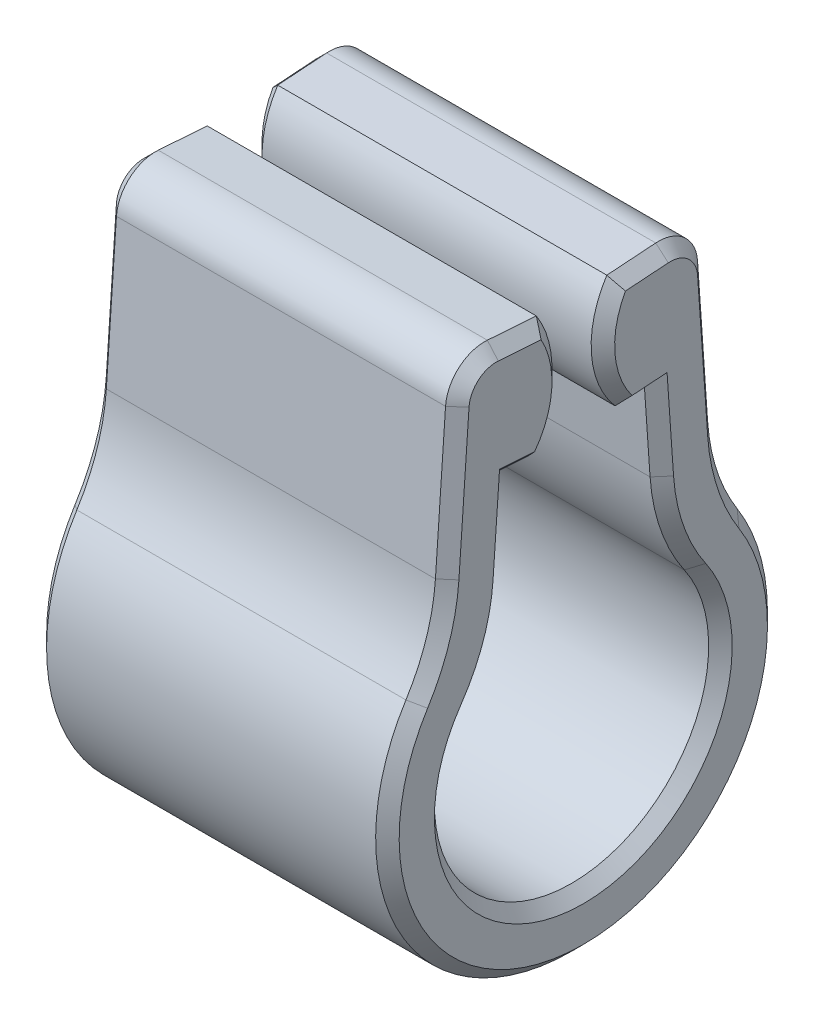
from build123d import *

# Parameters (mm, degrees)
BOSS_EXTRUDE1_DEPTH = 18
FILLET1_R           = 2
CHAMFER1_SIZE       = 0.6


with BuildPart() as part:
    # Sketch2 → Boss-Extrude1 (new body)
    with BuildSketch(Plane(origin=(-5, 5, -3), x_dir=(0, 1, 0), z_dir=(-1, 0, 0))):
        with BuildLine():
            Line((16.373766646, 1.800474378), (16.687926286, 6.293166529))
            Line((16.687926286, 6.293166529), (7.318960954, 6.948308405))
            ThreePointArc((7.318960954, 6.948308405), (4.926891937, 7.41631163), (2.721626751, 8.45449594))
            ThreePointArc((2.721626751, 8.45449594), (-12.618925504, 0), (2.721626751, -8.45449594))
            ThreePointArc((2.721626751, -8.45449594), (4.926891937, -7.41631163), (7.318960954, -6.948308405))
            Line((7.318960954, -6.948308405), (16.687926286, -6.293166529))
            Line((16.687926286, -6.293166529), (16.373766646, -1.800474378))
            ThreePointArc((16.373766646, -1.800474378), (13.311318022, -1.012179749), (10.388382345, -2.21901322))
            Line((10.388382345, -2.21901322), (10.493272563, -3.71901322))
            Line((10.493272563, -3.71901322), (6.349775255, -4.008754777))
            ThreePointArc((6.349775255, -4.008754777), (3.737837364, -4.547913289), (1.361301465, -5.758280409))
            ThreePointArc((1.361301465, -5.758280409), (-9.618925504, 0), (1.361301465, 5.758280409))
            ThreePointArc((1.361301465, 5.758280409), (3.737837364, 4.547913289), (6.349775255, 4.008754777))
            Line((6.349775255, 4.008754777), (10.493272563, 3.71901322))
            Line((10.493272563, 3.71901322), (10.388382345, 2.21901322))
            ThreePointArc((10.388382345, 2.21901322), (13.311318022, 1.012179749), (16.373766646, 1.800474378))
        make_face()
    extrude(amount=BOSS_EXTRUDE1_DEPTH)

    # Fillet1
    fillet1_edges = [part.edges().sort_by_distance(p)[0] for p in [
        (-14, 21.687926286, 3.293166529),
        (-14, 21.687926286, -9.293166529),
    ]]
    fillet(fillet1_edges, radius=FILLET1_R)

    # Chamfer1
    chamfer1_edges = [part.edges().sort_by_distance(p)[0] for p in [
        (-23, -4.618925504, -3),
        (-23, 8.737837364, -7.547913289),
        (-5, 13.421523909, 0.863883999),
        (-5, 15.440827454, -0.03098678),
        (-5, 18.311318022, -1.987820251),
        (-5, 21.461089992, 0.049256403),
        (-5, 9.926891937, 4.41631163),
        (-5, -7.618925504, -3),
        (-23, 13.421523909, -6.863883999),
        (-5, 9.926891937, -10.41631163),
        (-5, 21.461089992, -6.049256403),
        (-5, 18.311318022, -4.012179749),
        (-5, 15.440827454, -5.96901322),
        (-5, 13.421523909, -6.863883999),
        (-5, 8.737837364, -7.547913289),
        (-5, -4.618925504, -3),
        (-5, 8.737837364, 1.547913289),
        (-23, 15.440827454, -5.96901322),
        (-23, 18.311318022, -4.012179749),
        (-23, 21.461089992, -6.049256403),
        (-23, 9.926891937, -10.41631163),
        (-5, 16.00587957, 3.690493941),
        (-5, 16.00587957, -9.690493941),
        (-5, 21.062704398, -8.749669433),
        (-23, -7.618925504, -3),
        (-5, 21.062704398, 2.749669433),
        (-23, 16.00587957, 3.690493941),
        (-23, 16.00587957, -9.690493941),
        (-23, 21.062704398, -8.749669433),
        (-23, 21.062704398, 2.749669433),
        (-23, 9.926891937, 4.41631163),
        (-23, 8.737837364, 1.547913289),
        (-23, 21.461089992, 0.049256403),
        (-23, 18.311318022, -1.987820251),
        (-23, 15.440827454, -0.03098678),
        (-23, 13.421523909, 0.863883999),
    ]]
    chamfer(chamfer1_edges, length=CHAMFER1_SIZE)


solid = part.part
